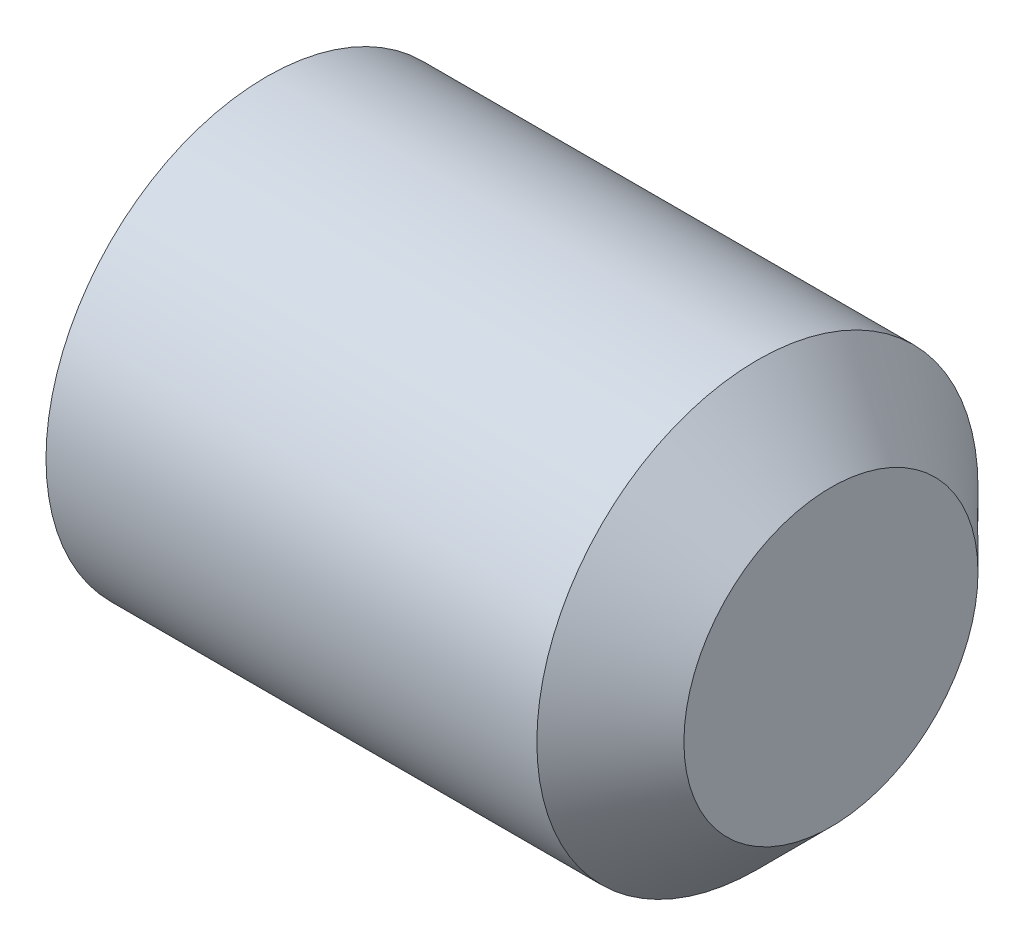
from build123d import *

# Parameters (mm, degrees)
HEX_2_DEPTH = 2


with BuildPart() as part:
    # BodySke → BaseBody (revolve)
    with BuildSketch(Plane.XY, mode=Mode.PRIVATE) as basebody_sk:
        Polygon((0, 0), (0, 1.2195), (0.161946751, 1.5), (3.5, 1.5), (4, 1), (4, 0), align=None)
    revolve(basebody_sk.sketch.rotate(Axis((-12.7, 0, 0), (1, 0, 0)), 90), axis=Axis((-12.7, 0, 0), (1, 0, 0)))

    # Sketch2 → Hex 2 (cut)
    with BuildSketch(Plane.ZY):
        Polygon((0.433012702, 0.75), (-0.433012702, 0.75), (-0.866025404, 0), (-0.433012702, -0.75), (0.433012702, -0.75), (0.866025404, 0), align=None)
    extrude(amount=-HEX_2_DEPTH, mode=Mode.SUBTRACT)


solid = part.part
